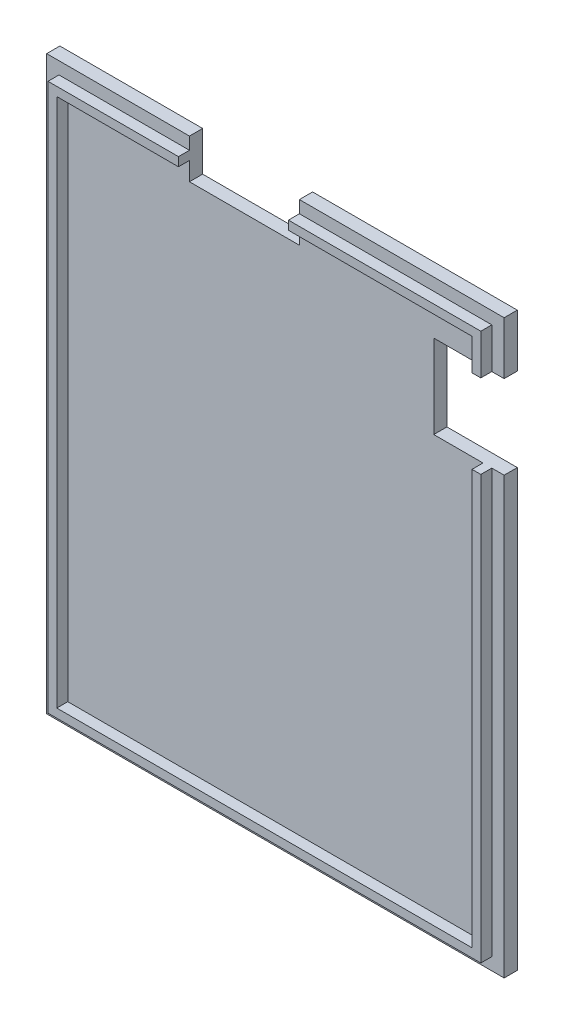
from build123d import *

# Parameters (mm, degrees)
SKETCH_1_W          = 104
SKETCH_1_H          = 130
EXTRUDE_1_DEPTH     = 3
SKETCH_2_W          = 98.4
SKETCH_2_H          = 124.4
SKETCH_2_W_2        = 94.4
SKETCH_2_H_2        = 120.4
EXTRUDE_2_DEPTH     = 2.5
SKETCH_3_W          = 16
SKETCH_3_H          = 19
SKETCH_3_W_2        = 25
SKETCH_3_H_2        = 9
CUT_EXTRUDE_1_DEPTH = 84.422119369


with BuildPart() as part:
    # 草圖1 → 填料-伸長1 (new body)
    with BuildSketch(Plane.XY):
        Rectangle(SKETCH_1_W, SKETCH_1_H)
    extrude(amount=EXTRUDE_1_DEPTH)

    # 草圖2 → 填料-伸長2 (add)
    with BuildSketch(Plane.XY.offset(3)):
        Rectangle(SKETCH_2_W, SKETCH_2_H)
        Rectangle(SKETCH_2_W_2, SKETCH_2_H_2, mode=Mode.SUBTRACT)
    extrude(amount=EXTRUDE_2_DEPTH)

    # 草圖3 → 除料-伸長1 (cut, through all)
    with BuildSketch(Plane(origin=(0, 0, 0), x_dir=(-1, 0, 0), z_dir=(0, 0, -1))):
        with Locations((-44, 43.5)):
            Rectangle(SKETCH_3_W, SKETCH_3_H)
        with Locations((7.041187405, 60.5)):
            Rectangle(SKETCH_3_W_2, SKETCH_3_H_2)
    extrude(amount=-CUT_EXTRUDE_1_DEPTH, mode=Mode.SUBTRACT)


solid = part.part
